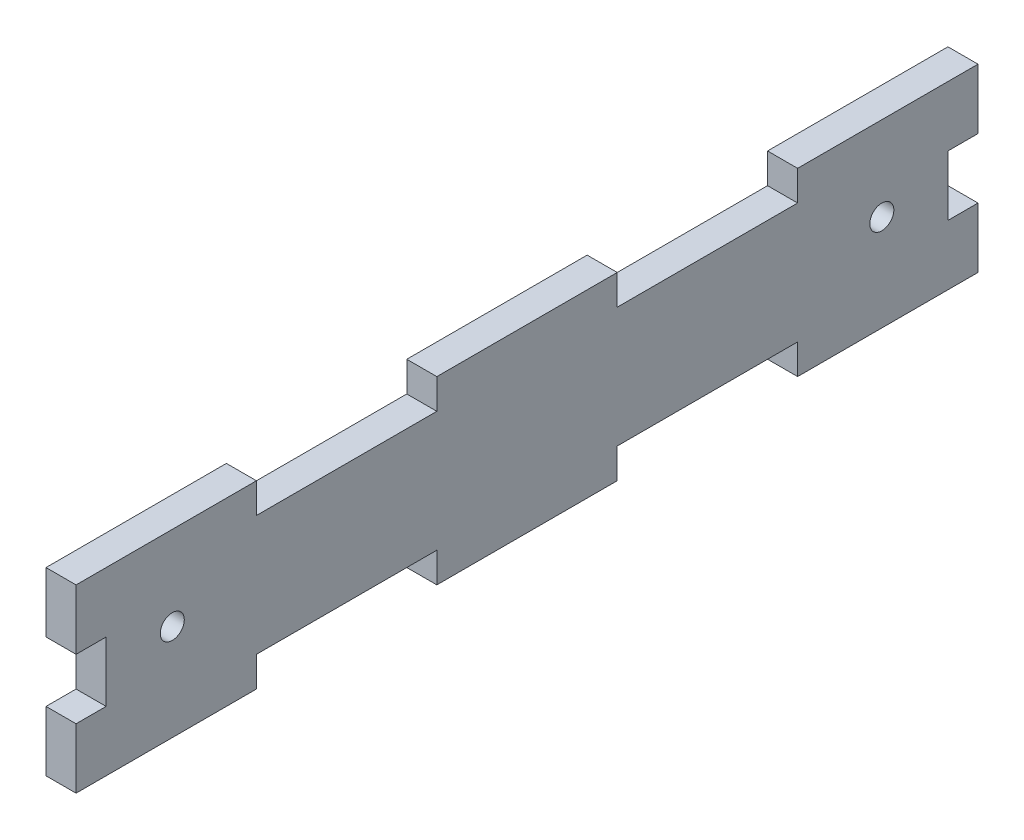
from build123d import *

# Parameters (mm, degrees)
CROQUIS1_R              = 2
SALIENTE_EXTRUIR1_DEPTH = 5


with BuildPart() as part:
    # Croquis1 → Saliente-Extruir1 (new body)
    with BuildSketch(Plane(origin=(0, 0, 0), x_dir=(0, 0, -1), z_dir=(1, 0, 0))):
        Polygon((0, 20), (5, 20), (5, 10), (0, 10), (0, 0), (30, 0), (30, 5), (60, 5), (60, 0), (90, 0), (90, 5), (120, 5), (120, 0), (150, 0), (150, 10), (145, 10), (145, 20), (150, 20), (150, 30), (120, 30), (120, 25), (90, 25), (90, 30), (60, 30), (60, 25), (30, 25), (30, 30), (0, 30), align=None)
        with Locations((16, 16)):
            Circle(CROQUIS1_R, mode=Mode.SUBTRACT)
        with Locations(Location((134, 16, 0), (0, 0, 180))):
            Circle(CROQUIS1_R, mode=Mode.SUBTRACT)
    extrude(amount=SALIENTE_EXTRUIR1_DEPTH)


solid = part.part
